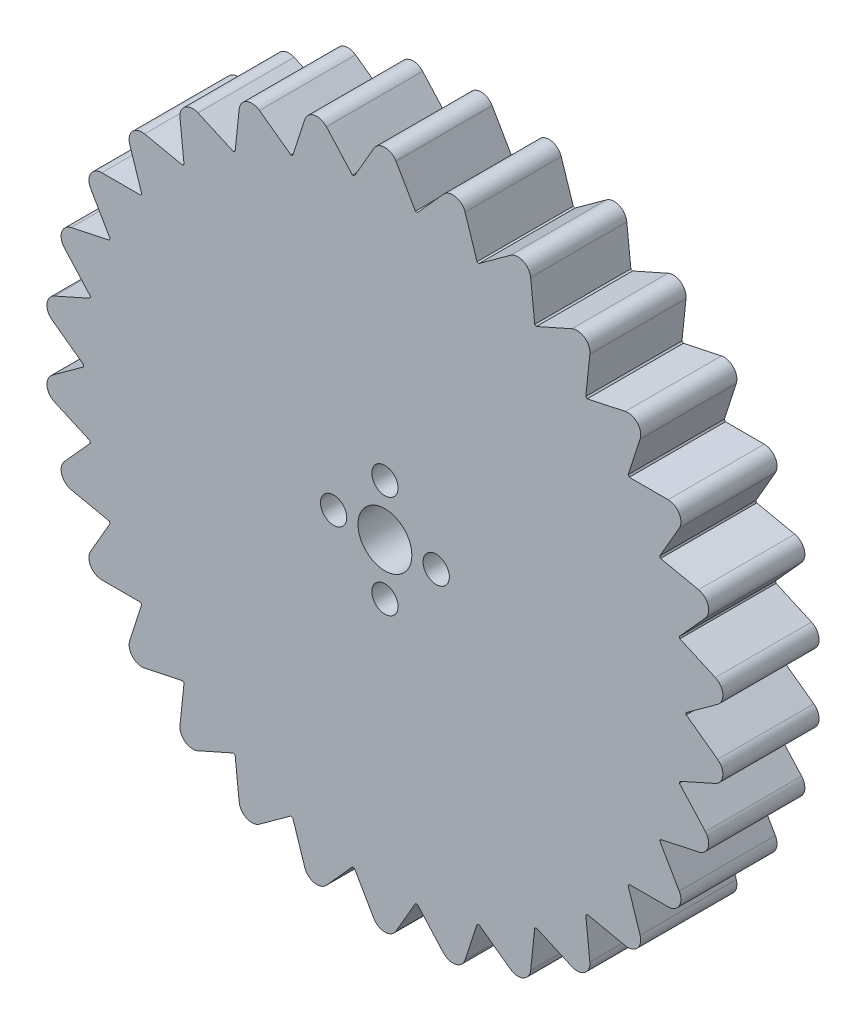
from build123d import *

# Parameters (mm, degrees)
SKETCH1_R           = 4.2
SKETCH1_R_2         = 2.05
BOSS_EXTRUDE1_DEPTH = 15


with BuildPart() as part:
    # Sketch1 → Boss-Extrude1 (new body)
    with BuildSketch(Plane.XY):
        with BuildLine():
            Line((-1.732050808, 52), (-4.758219757, 46.758521627))
            ThreePointArc((-4.758219757, 46.758521627), (-4.912837774, 46.742529082), (-5.067402052, 46.726025258))
            Line((-5.067402052, 46.726025258), (-9.117206581, 51.22378885))
            ThreePointArc((-9.117206581, 51.22378885), (-11.019319613, 51.841822839), (-12.505609264, 50.503561626))
            Line((-12.505609264, 50.503561626), (-14.375884531, 44.747446228))
            ThreePointArc((-14.375884531, 44.747446228), (-14.523798736, 44.699656266), (-14.671554076, 44.651377369))
            Line((-14.671554076, 44.651377369), (-19.567998292, 48.208852329))
            ThreePointArc((-19.567998292, 48.208852329), (-21.557042083, 48.417909255), (-22.732612588, 46.799875266))
            Line((-22.732612588, 46.799875266), (-23.365254167, 40.780692707))
            ThreePointArc((-23.365254167, 40.780692707), (-23.5, 40.703193978), (-23.634488785, 40.625250029))
            Line((-23.634488785, 40.625250029), (-29.163574581, 43.086957628))
            ThreePointArc((-29.163574581, 43.086957628), (-31.152618372, 42.877900702), (-31.966091658, 41.050809787))
            Line((-31.966091658, 41.050809787), (-31.333450078, 35.031627228))
            ThreePointArc((-31.333450078, 35.031627228), (-31.449138499, 34.927806797), (-31.564482923, 34.82360432))
            Line((-31.564482923, 34.82360432), (-37.484562718, 36.081956126))
            ThreePointArc((-37.484562718, 36.081956126), (-39.38667575, 35.463922137), (-39.802499132, 33.507626936))
            Line((-39.802499132, 33.507626936), (-37.932223865, 27.751511538))
            ThreePointArc((-37.932223865, 27.751511538), (-38.023798736, 27.625906858), (-38.114957694, 27.5))
            Line((-38.114957694, 27.5), (-44.167295593, 27.5))
            ThreePointArc((-44.167295593, 27.5), (-45.899346401, 26.5), (-45.899346401, 24.5))
            Line((-45.899346401, 24.5), (-42.873177451, 19.258521627))
            ThreePointArc((-42.873177451, 19.258521627), (-42.936636509, 19.116622225), (-42.999625918, 18.974513721))
            Line((-42.999625918, 18.974513721), (-48.919705713, 17.716161915))
            ThreePointArc((-48.919705713, 17.716161915), (-50.405995364, 16.377900702), (-49.990171982, 14.4216055))
            Line((-49.990171982, 14.4216055), (-45.940367454, 9.923841909))
            ThreePointArc((-45.940367454, 9.923841909), (-45.972937234, 9.771849468), (-46.005004154, 9.619750142))
            Line((-46.005004154, 9.619750142), (-51.53408995, 7.158042542))
            ThreePointArc((-51.53408995, 7.158042542), (-52.709660455, 5.540008553), (-51.896187168, 3.712917638))
            Line((-51.896187168, 3.712917638), (-46.999742952, 0.155442679))
            ThreePointArc((-46.999742952, 0.155442679), (-47, 0), (-46.999742952, -0.155442679))
            Line((-46.999742952, -0.155442679), (-51.896187168, -3.712917638))
            ThreePointArc((-51.896187168, -3.712917638), (-52.709660455, -5.540008553), (-51.53408995, -7.158042542))
            Line((-51.53408995, -7.158042542), (-46.005004154, -9.619750142))
            ThreePointArc((-46.005004154, -9.619750142), (-45.972937234, -9.771849468), (-45.940367454, -9.923841909))
            Line((-45.940367454, -9.923841909), (-49.990171982, -14.4216055))
            ThreePointArc((-49.990171982, -14.4216055), (-50.405995364, -16.377900702), (-48.919705713, -17.716161915))
            Line((-48.919705713, -17.716161915), (-42.999625918, -18.974513721))
            ThreePointArc((-42.999625918, -18.974513721), (-42.936636509, -19.116622225), (-42.873177451, -19.258521627))
            Line((-42.873177451, -19.258521627), (-45.899346401, -24.5))
            ThreePointArc((-45.899346401, -24.5), (-45.899346401, -26.5), (-44.167295593, -27.5))
            Line((-44.167295593, -27.5), (-38.114957694, -27.5))
            ThreePointArc((-38.114957694, -27.5), (-38.023798736, -27.625906858), (-37.932223865, -27.751511538))
            Line((-37.932223865, -27.751511538), (-39.802499132, -33.507626936))
            ThreePointArc((-39.802499132, -33.507626936), (-39.38667575, -35.463922137), (-37.484562718, -36.081956126))
            Line((-37.484562718, -36.081956126), (-31.564482923, -34.82360432))
            ThreePointArc((-31.564482923, -34.82360432), (-31.449138499, -34.927806797), (-31.333450078, -35.031627228))
            Line((-31.333450078, -35.031627228), (-31.966091658, -41.050809787))
            ThreePointArc((-31.966091658, -41.050809787), (-31.152618372, -42.877900702), (-29.163574581, -43.086957628))
            Line((-29.163574581, -43.086957628), (-23.634488785, -40.625250029))
            ThreePointArc((-23.634488785, -40.625250029), (-23.5, -40.703193978), (-23.365254167, -40.780692707))
            Line((-23.365254167, -40.780692707), (-22.732612588, -46.799875266))
            ThreePointArc((-22.732612588, -46.799875266), (-21.557042083, -48.417909255), (-19.567998292, -48.208852329))
            Line((-19.567998292, -48.208852329), (-14.671554076, -44.651377369))
            ThreePointArc((-14.671554076, -44.651377369), (-14.523798736, -44.699656266), (-14.375884531, -44.747446228))
            Line((-14.375884531, -44.747446228), (-12.505609264, -50.503561626))
            ThreePointArc((-12.505609264, -50.503561626), (-11.019319613, -51.841822839), (-9.117206581, -51.22378885))
            Line((-9.117206581, -51.22378885), (-5.067402052, -46.726025258))
            ThreePointArc((-5.067402052, -46.726025258), (-4.912837774, -46.742529082), (-4.758219757, -46.758521627))
            Line((-4.758219757, -46.758521627), (-1.732050808, -52))
            ThreePointArc((-1.732050808, -52), (0, -53), (1.732050808, -52))
            Line((1.732050808, -52), (4.758219757, -46.758521627))
            ThreePointArc((4.758219757, -46.758521627), (4.912837774, -46.742529082), (5.067402052, -46.726025258))
            Line((5.067402052, -46.726025258), (9.117206581, -51.22378885))
            ThreePointArc((9.117206581, -51.22378885), (11.019319613, -51.841822839), (12.505609264, -50.503561626))
            Line((12.505609264, -50.503561626), (14.375884531, -44.747446228))
            ThreePointArc((14.375884531, -44.747446228), (14.523798736, -44.699656266), (14.671554076, -44.651377369))
            Line((14.671554076, -44.651377369), (19.567998292, -48.208852329))
            ThreePointArc((19.567998292, -48.208852329), (21.557042083, -48.417909255), (22.732612588, -46.799875266))
            Line((22.732612588, -46.799875266), (23.365254167, -40.780692707))
            ThreePointArc((23.365254167, -40.780692707), (23.5, -40.703193978), (23.634488785, -40.625250029))
            Line((23.634488785, -40.625250029), (29.163574581, -43.086957628))
            ThreePointArc((29.163574581, -43.086957628), (31.152618372, -42.877900702), (31.966091658, -41.050809787))
            Line((31.966091658, -41.050809787), (31.333450078, -35.031627228))
            ThreePointArc((31.333450078, -35.031627228), (31.449138499, -34.927806797), (31.564482923, -34.82360432))
            Line((31.564482923, -34.82360432), (37.484562718, -36.081956126))
            ThreePointArc((37.484562718, -36.081956126), (39.38667575, -35.463922137), (39.802499132, -33.507626936))
            Line((39.802499132, -33.507626936), (37.932223865, -27.751511538))
            ThreePointArc((37.932223865, -27.751511538), (38.023798736, -27.625906858), (38.114957694, -27.5))
            Line((38.114957694, -27.5), (44.167295593, -27.5))
            ThreePointArc((44.167295593, -27.5), (45.899346401, -26.5), (45.899346401, -24.5))
            Line((45.899346401, -24.5), (42.873177451, -19.258521627))
            ThreePointArc((42.873177451, -19.258521627), (42.936636509, -19.116622225), (42.999625918, -18.974513721))
            Line((42.999625918, -18.974513721), (48.919705713, -17.716161915))
            ThreePointArc((48.919705713, -17.716161915), (50.405995364, -16.377900702), (49.990171982, -14.4216055))
            Line((49.990171982, -14.4216055), (45.940367454, -9.923841909))
            ThreePointArc((45.940367454, -9.923841909), (45.972937234, -9.771849468), (46.005004154, -9.619750142))
            Line((46.005004154, -9.619750142), (51.53408995, -7.158042542))
            ThreePointArc((51.53408995, -7.158042542), (52.709660455, -5.540008553), (51.896187168, -3.712917638))
            Line((51.896187168, -3.712917638), (46.999742952, -0.155442679))
            ThreePointArc((46.999742952, -0.155442679), (47, 0), (46.999742952, 0.155442679))
            Line((46.999742952, 0.155442679), (51.896187168, 3.712917638))
            ThreePointArc((51.896187168, 3.712917638), (52.709660455, 5.540008553), (51.53408995, 7.158042542))
            Line((51.53408995, 7.158042542), (46.005004154, 9.619750142))
            ThreePointArc((46.005004154, 9.619750142), (45.972937234, 9.771849468), (45.940367454, 9.923841909))
            Line((45.940367454, 9.923841909), (49.990171982, 14.4216055))
            ThreePointArc((49.990171982, 14.4216055), (50.405995364, 16.377900702), (48.919705713, 17.716161915))
            Line((48.919705713, 17.716161915), (42.999625918, 18.974513721))
            ThreePointArc((42.999625918, 18.974513721), (42.936636509, 19.116622225), (42.873177451, 19.258521627))
            Line((42.873177451, 19.258521627), (45.899346401, 24.5))
            ThreePointArc((45.899346401, 24.5), (45.899346401, 26.5), (44.167295593, 27.5))
            Line((44.167295593, 27.5), (38.114957694, 27.5))
            ThreePointArc((38.114957694, 27.5), (38.023798736, 27.625906858), (37.932223865, 27.751511538))
            Line((37.932223865, 27.751511538), (39.802499132, 33.507626936))
            ThreePointArc((39.802499132, 33.507626936), (39.38667575, 35.463922137), (37.484562718, 36.081956126))
            Line((37.484562718, 36.081956126), (31.564482923, 34.82360432))
            ThreePointArc((31.564482923, 34.82360432), (31.449138499, 34.927806797), (31.333450078, 35.031627228))
            Line((31.333450078, 35.031627228), (31.966091658, 41.050809787))
            ThreePointArc((31.966091658, 41.050809787), (31.152618372, 42.877900702), (29.163574581, 43.086957628))
            Line((29.163574581, 43.086957628), (23.634488785, 40.625250029))
            ThreePointArc((23.634488785, 40.625250029), (23.5, 40.703193978), (23.365254167, 40.780692707))
            Line((23.365254167, 40.780692707), (22.732612588, 46.799875266))
            ThreePointArc((22.732612588, 46.799875266), (21.557042083, 48.417909255), (19.567998292, 48.208852329))
            Line((19.567998292, 48.208852329), (14.671554076, 44.651377369))
            ThreePointArc((14.671554076, 44.651377369), (14.523798736, 44.699656266), (14.375884531, 44.747446228))
            Line((14.375884531, 44.747446228), (12.505609264, 50.503561626))
            ThreePointArc((12.505609264, 50.503561626), (11.019319613, 51.841822839), (9.117206581, 51.22378885))
            Line((9.117206581, 51.22378885), (5.067402052, 46.726025258))
            ThreePointArc((5.067402052, 46.726025258), (4.912837774, 46.742529082), (4.758219757, 46.758521627))
            Line((4.758219757, 46.758521627), (1.732050808, 52))
            ThreePointArc((1.732050808, 52), (0, 53), (-1.732050808, 52))
        make_face()
        Circle(SKETCH1_R, mode=Mode.SUBTRACT)
        with Locations((0, 8)):
            Circle(SKETCH1_R_2, mode=Mode.SUBTRACT)
        with Locations((8, 0)):
            Circle(SKETCH1_R_2, mode=Mode.SUBTRACT)
        with Locations((0, -8)):
            Circle(SKETCH1_R_2, mode=Mode.SUBTRACT)
        with Locations((-8, 0)):
            Circle(SKETCH1_R_2, mode=Mode.SUBTRACT)
    extrude(amount=BOSS_EXTRUDE1_DEPTH)


solid = part.part
